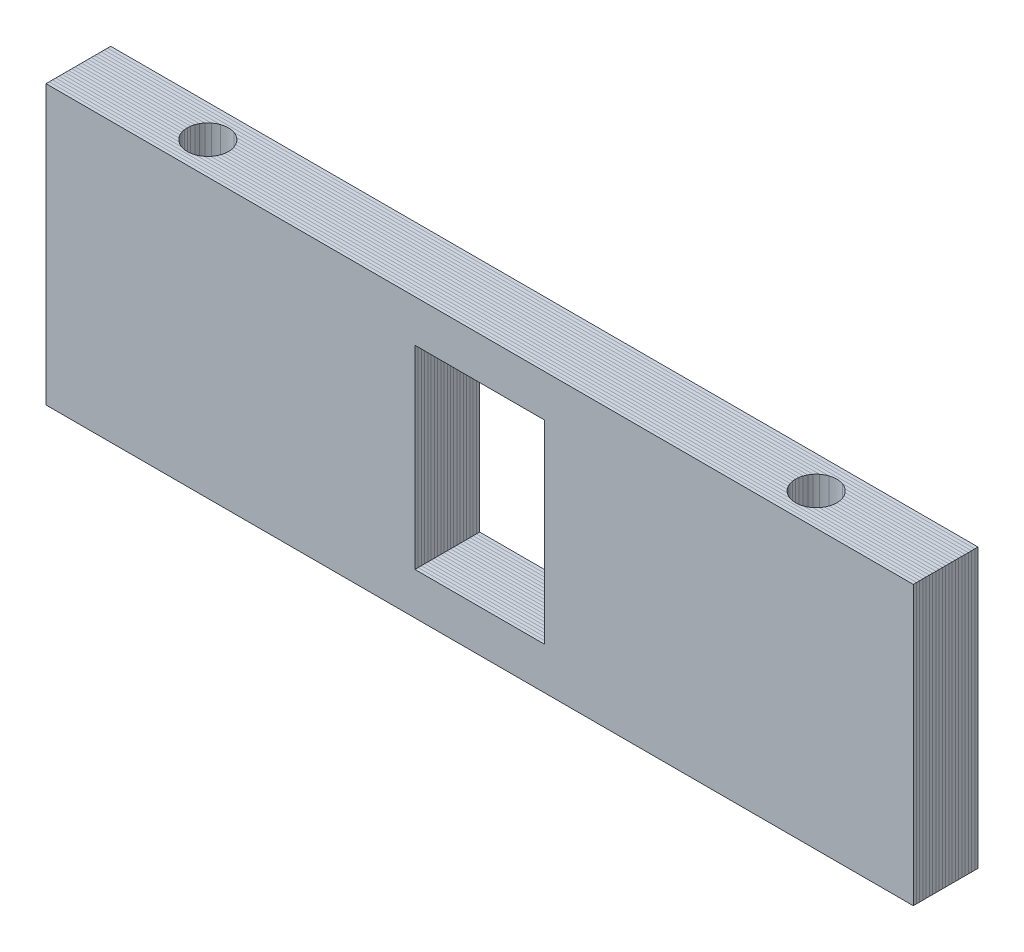
from build123d import *

# Parameters (mm, degrees)
ESBO_O1_W                                    = 134
ESBO_O1_H                                    = 43
ESBO_O1_W_2                                  = 20
ESBO_O1_H_2                                  = 30
RESSALTO_EXTRUS_O1_DEPTH                     = 0.5
ESBO_O2_W                                    = 134
ESBO_O2_H                                    = 43
ESBO_O2_W_2                                  = 20
ESBO_O2_H_2                                  = 30
RESSALTO_EXTRUS_O9_DEPTH                     = 0.5
ESBO_O7_W                                    = 134
ESBO_O7_H                                    = 43
ESBO_O7_W_2                                  = 20
ESBO_O7_H_2                                  = 30
RESSALTO_EXTRUS_O10_DEPTH                    = 0.5
ESBO_O8_W                                    = 134
ESBO_O8_H                                    = 43
ESBO_O8_W_2                                  = 20
ESBO_O8_H_2                                  = 30
RESSALTO_EXTRUS_O11_DEPTH                    = 0.5
ESBO_O9_W                                    = 134
ESBO_O9_H                                    = 43
ESBO_O9_W_2                                  = 20
ESBO_O9_H_2                                  = 30
RESSALTO_EXTRUS_O12_DEPTH                    = 0.5
ESBO_O10_W                                   = 134
ESBO_O10_H                                   = 43
ESBO_O10_W_2                                 = 20
ESBO_O10_H_2                                 = 30
RESSALTO_EXTRUS_O13_DEPTH                    = 0.5
ESBO_O11_W                                   = 134
ESBO_O11_H                                   = 43
ESBO_O11_W_2                                 = 20
ESBO_O11_H_2                                 = 30
RESSALTO_EXTRUS_O14_DEPTH                    = 0.5
ESBO_O12_W                                   = 134
ESBO_O12_H                                   = 43
ESBO_O12_W_2                                 = 20
ESBO_O12_H_2                                 = 30
RESSALTO_EXTRUS_O15_DEPTH                    = 0.5
ESBO_O13_W                                   = 134
ESBO_O13_H                                   = 43
ESBO_O13_W_2                                 = 20
ESBO_O13_H_2                                 = 30
RESSALTO_EXTRUS_O16_DEPTH                    = 0.5
ESBO_O14_W                                   = 134
ESBO_O14_H                                   = 43
ESBO_O14_W_2                                 = 20
ESBO_O14_H_2                                 = 30
RESSALTO_EXTRUS_O17_DEPTH                    = 0.5
ESBO_O15_W                                   = 134
ESBO_O15_H                                   = 43
ESBO_O15_W_2                                 = 20
ESBO_O15_H_2                                 = 30
RESSALTO_EXTRUS_O18_DEPTH                    = 0.5
ESBO_O16_W                                   = 134
ESBO_O16_H                                   = 43
ESBO_O16_W_2                                 = 20
ESBO_O16_H_2                                 = 30
RESSALTO_EXTRUS_O19_DEPTH                    = 0.5
ESBO_O17_W                                   = 134
ESBO_O17_H                                   = 43
ESBO_O17_W_2                                 = 20
ESBO_O17_H_2                                 = 30
RESSALTO_EXTRUS_O20_DEPTH                    = 0.5
ESBO_O18_W                                   = 134
ESBO_O18_H                                   = 43
ESBO_O18_W_2                                 = 20
ESBO_O18_H_2                                 = 30
RESSALTO_EXTRUS_O21_DEPTH                    = 0.5
ESBO_O19_W                                   = 134
ESBO_O19_H                                   = 43
ESBO_O19_W_2                                 = 20
ESBO_O19_H_2                                 = 30
RESSALTO_EXTRUS_O22_DEPTH                    = 0.5
ESBO_O20_W                                   = 134
ESBO_O20_H                                   = 43
ESBO_O20_W_2                                 = 20
ESBO_O20_H_2                                 = 30
RESSALTO_EXTRUS_O23_DEPTH                    = 0.5
ESBO_O21_W                                   = 134
ESBO_O21_H                                   = 43
ESBO_O21_W_2                                 = 20
ESBO_O21_H_2                                 = 30
RESSALTO_EXTRUS_O24_DEPTH                    = 0.5
ESBO_O22_W                                   = 134
ESBO_O22_H                                   = 43
ESBO_O22_W_2                                 = 20
ESBO_O22_H_2                                 = 30
RESSALTO_EXTRUS_O25_DEPTH                    = 0.5
ESBO_O23_W                                   = 134
ESBO_O23_H                                   = 43
ESBO_O23_W_2                                 = 20
ESBO_O23_H_2                                 = 30
RESSALTO_EXTRUS_O26_DEPTH                    = 0.5
ESBO_O24_W                                   = 134
ESBO_O24_H                                   = 43
ESBO_O24_W_2                                 = 20
ESBO_O24_H_2                                 = 30
RESSALTO_EXTRUS_O27_DEPTH                    = 0.5
BROCA_DE_ROSQUEAR_PARA_TARRAXA_DE_M3_2_COUNT = 2
BROCA_DE_ROSQUEAR_PARA_TARRAXA_DE_M3_2_PITCH = 94


with BuildPart() as part:
    # Esboço1 → Ressalto-extrusão1 (new body)
    with BuildSketch(Plane.XY):
        with Locations((-67, 21.5)):
            Rectangle(ESBO_O1_W, ESBO_O1_H)
        with Locations((-67, 21.5)):
            Rectangle(ESBO_O1_W_2, ESBO_O1_H_2, mode=Mode.SUBTRACT)
    extrude(amount=RESSALTO_EXTRUS_O1_DEPTH)


with BuildPart() as body_2:
    # Esboço2 → Ressalto-extrusão9 (new body)
    with BuildSketch(Plane.XY.offset(0.5)):
        with Locations((-67, 21.5)):
            Rectangle(ESBO_O2_W, ESBO_O2_H)
        with Locations((-67, 21.5)):
            Rectangle(ESBO_O2_W_2, ESBO_O2_H_2, mode=Mode.SUBTRACT)
    extrude(amount=RESSALTO_EXTRUS_O9_DEPTH)


with BuildPart() as body_3:
    # Esboço7 → Ressalto-extrusão10 (new body)
    with BuildSketch(Plane.XY.offset(1)):
        with Locations((-67, 21.5)):
            Rectangle(ESBO_O7_W, ESBO_O7_H)
        with Locations((-67, 21.5)):
            Rectangle(ESBO_O7_W_2, ESBO_O7_H_2, mode=Mode.SUBTRACT)
    extrude(amount=RESSALTO_EXTRUS_O10_DEPTH)


with BuildPart() as body_4:
    # Esboço8 → Ressalto-extrusão11 (new body)
    with BuildSketch(Plane.XY.offset(1.5)):
        with Locations((-67, 21.5)):
            Rectangle(ESBO_O8_W, ESBO_O8_H)
        with Locations((-67, 21.5)):
            Rectangle(ESBO_O8_W_2, ESBO_O8_H_2, mode=Mode.SUBTRACT)
    extrude(amount=RESSALTO_EXTRUS_O11_DEPTH)


with BuildPart() as body_5:
    # Esboço9 → Ressalto-extrusão12 (new body)
    with BuildSketch(Plane.XY.offset(2)):
        with Locations((-67, 21.5)):
            Rectangle(ESBO_O9_W, ESBO_O9_H)
        with Locations((-67, 21.5)):
            Rectangle(ESBO_O9_W_2, ESBO_O9_H_2, mode=Mode.SUBTRACT)
    extrude(amount=RESSALTO_EXTRUS_O12_DEPTH)


with BuildPart() as body_6:
    # Esboço10 → Ressalto-extrusão13 (new body)
    with BuildSketch(Plane.XY.offset(2.5)):
        with Locations((-67, 21.5)):
            Rectangle(ESBO_O10_W, ESBO_O10_H)
        with Locations((-67, 21.5)):
            Rectangle(ESBO_O10_W_2, ESBO_O10_H_2, mode=Mode.SUBTRACT)
    extrude(amount=RESSALTO_EXTRUS_O13_DEPTH)


with BuildPart() as body_7:
    # Esboço11 → Ressalto-extrusão14 (new body)
    with BuildSketch(Plane.XY.offset(3)):
        with Locations((-67, 21.5)):
            Rectangle(ESBO_O11_W, ESBO_O11_H)
        with Locations((-67, 21.5)):
            Rectangle(ESBO_O11_W_2, ESBO_O11_H_2, mode=Mode.SUBTRACT)
    extrude(amount=RESSALTO_EXTRUS_O14_DEPTH)


with BuildPart() as body_8:
    # Esboço12 → Ressalto-extrusão15 (new body)
    with BuildSketch(Plane.XY.offset(3.5)):
        with Locations((-67, 21.5)):
            Rectangle(ESBO_O12_W, ESBO_O12_H)
        with Locations((-67, 21.5)):
            Rectangle(ESBO_O12_W_2, ESBO_O12_H_2, mode=Mode.SUBTRACT)
    extrude(amount=RESSALTO_EXTRUS_O15_DEPTH)


with BuildPart() as body_9:
    # Esboço13 → Ressalto-extrusão16 (new body)
    with BuildSketch(Plane.XY.offset(4)):
        with Locations((-67, 21.5)):
            Rectangle(ESBO_O13_W, ESBO_O13_H)
        with Locations((-67, 21.5)):
            Rectangle(ESBO_O13_W_2, ESBO_O13_H_2, mode=Mode.SUBTRACT)
    extrude(amount=RESSALTO_EXTRUS_O16_DEPTH)


with BuildPart() as body_10:
    # Esboço14 → Ressalto-extrusão17 (new body)
    with BuildSketch(Plane.XY.offset(4.5)):
        with Locations((-67, 21.5)):
            Rectangle(ESBO_O14_W, ESBO_O14_H)
        with Locations((-67, 21.5)):
            Rectangle(ESBO_O14_W_2, ESBO_O14_H_2, mode=Mode.SUBTRACT)
    extrude(amount=RESSALTO_EXTRUS_O17_DEPTH)


with BuildPart() as body_11:
    # Esboço15 → Ressalto-extrusão18 (new body)
    with BuildSketch(Plane.XY.offset(5)):
        with Locations((-67, 21.5)):
            Rectangle(ESBO_O15_W, ESBO_O15_H)
        with Locations((-67, 21.5)):
            Rectangle(ESBO_O15_W_2, ESBO_O15_H_2, mode=Mode.SUBTRACT)
    extrude(amount=RESSALTO_EXTRUS_O18_DEPTH)


with BuildPart() as body_12:
    # Esboço16 → Ressalto-extrusão19 (new body)
    with BuildSketch(Plane.XY.offset(5.5)):
        with Locations((-67, 21.5)):
            Rectangle(ESBO_O16_W, ESBO_O16_H)
        with Locations((-67, 21.5)):
            Rectangle(ESBO_O16_W_2, ESBO_O16_H_2, mode=Mode.SUBTRACT)
    extrude(amount=RESSALTO_EXTRUS_O19_DEPTH)


with BuildPart() as body_13:
    # Esboço17 → Ressalto-extrusão20 (new body)
    with BuildSketch(Plane.XY.offset(6)):
        with Locations((-67, 21.5)):
            Rectangle(ESBO_O17_W, ESBO_O17_H)
        with Locations((-67, 21.5)):
            Rectangle(ESBO_O17_W_2, ESBO_O17_H_2, mode=Mode.SUBTRACT)
    extrude(amount=RESSALTO_EXTRUS_O20_DEPTH)


with BuildPart() as body_14:
    # Esboço18 → Ressalto-extrusão21 (new body)
    with BuildSketch(Plane.XY.offset(6.5)):
        with Locations((-67, 21.5)):
            Rectangle(ESBO_O18_W, ESBO_O18_H)
        with Locations((-67, 21.5)):
            Rectangle(ESBO_O18_W_2, ESBO_O18_H_2, mode=Mode.SUBTRACT)
    extrude(amount=RESSALTO_EXTRUS_O21_DEPTH)


with BuildPart() as body_15:
    # Esboço19 → Ressalto-extrusão22 (new body)
    with BuildSketch(Plane.XY.offset(7)):
        with Locations((-67, 21.5)):
            Rectangle(ESBO_O19_W, ESBO_O19_H)
        with Locations((-67, 21.5)):
            Rectangle(ESBO_O19_W_2, ESBO_O19_H_2, mode=Mode.SUBTRACT)
    extrude(amount=RESSALTO_EXTRUS_O22_DEPTH)


with BuildPart() as body_16:
    # Esboço20 → Ressalto-extrusão23 (new body)
    with BuildSketch(Plane.XY.offset(7.5)):
        with Locations((-67, 21.5)):
            Rectangle(ESBO_O20_W, ESBO_O20_H)
        with Locations((-67, 21.5)):
            Rectangle(ESBO_O20_W_2, ESBO_O20_H_2, mode=Mode.SUBTRACT)
    extrude(amount=RESSALTO_EXTRUS_O23_DEPTH)


with BuildPart() as body_17:
    # Esboço21 → Ressalto-extrusão24 (new body)
    with BuildSketch(Plane.XY.offset(8)):
        with Locations((-67, 21.5)):
            Rectangle(ESBO_O21_W, ESBO_O21_H)
        with Locations((-67, 21.5)):
            Rectangle(ESBO_O21_W_2, ESBO_O21_H_2, mode=Mode.SUBTRACT)
    extrude(amount=RESSALTO_EXTRUS_O24_DEPTH)


with BuildPart() as body_18:
    # Esboço22 → Ressalto-extrusão25 (new body)
    with BuildSketch(Plane.XY.offset(8.5)):
        with Locations((-67, 21.5)):
            Rectangle(ESBO_O22_W, ESBO_O22_H)
        with Locations((-67, 21.5)):
            Rectangle(ESBO_O22_W_2, ESBO_O22_H_2, mode=Mode.SUBTRACT)
    extrude(amount=RESSALTO_EXTRUS_O25_DEPTH)


with BuildPart() as body_19:
    # Esboço23 → Ressalto-extrusão26 (new body)
    with BuildSketch(Plane.XY.offset(9)):
        with Locations((-67, 21.5)):
            Rectangle(ESBO_O23_W, ESBO_O23_H)
        with Locations((-67, 21.5)):
            Rectangle(ESBO_O23_W_2, ESBO_O23_H_2, mode=Mode.SUBTRACT)
    extrude(amount=RESSALTO_EXTRUS_O26_DEPTH)


with BuildPart() as body_20:
    # Esboço24 → Ressalto-extrusão27 (new body)
    with BuildSketch(Plane.XY.offset(9.5)):
        with Locations((-67, 21.5)):
            Rectangle(ESBO_O24_W, ESBO_O24_H)
        with Locations((-67, 21.5)):
            Rectangle(ESBO_O24_W_2, ESBO_O24_H_2, mode=Mode.SUBTRACT)
    extrude(amount=RESSALTO_EXTRUS_O27_DEPTH)


with BuildPart() as broca_de_rosquear_para_tarraxa_de_m3x0_5_tool:
    # Esboço27 → Broca de rosquear para tarraxa de M3x0.51 (revolve)
    with BuildSketch(Plane(origin=(-114, 43, 5), x_dir=(0, 0, 1), z_dir=(1, 0, 0))):
        Polygon((0, 0), (0, 25.4), (3.175, 23.492267535), (3.175, 0), align=None)
    broca_de_rosquear_para_tarraxa_de_m3x0_5 = revolve(axis=Axis((-114, 49.35, 5), (0, -1, 0)))


with BuildPart() as body_4_1:
    add(body_4.part)

    # Broca de rosquear para tarraxa de M3x0.51: cut by broca_de_rosquear_para_tarraxa_de_m3x0_5_tool
    add(broca_de_rosquear_para_tarraxa_de_m3x0_5_tool.part, mode=Mode.SUBTRACT)


with BuildPart() as body_5_1:
    add(body_5.part)

    # Broca de rosquear para tarraxa de M3x0.51: cut by broca_de_rosquear_para_tarraxa_de_m3x0_5_tool
    add(broca_de_rosquear_para_tarraxa_de_m3x0_5_tool.part, mode=Mode.SUBTRACT)


with BuildPart() as body_6_1:
    add(body_6.part)

    # Broca de rosquear para tarraxa de M3x0.51: cut by broca_de_rosquear_para_tarraxa_de_m3x0_5_tool
    add(broca_de_rosquear_para_tarraxa_de_m3x0_5_tool.part, mode=Mode.SUBTRACT)


with BuildPart() as body_7_1:
    add(body_7.part)

    # Broca de rosquear para tarraxa de M3x0.51: cut by broca_de_rosquear_para_tarraxa_de_m3x0_5_tool
    add(broca_de_rosquear_para_tarraxa_de_m3x0_5_tool.part, mode=Mode.SUBTRACT)


with BuildPart() as body_8_1:
    add(body_8.part)

    # Broca de rosquear para tarraxa de M3x0.51: cut by broca_de_rosquear_para_tarraxa_de_m3x0_5_tool
    add(broca_de_rosquear_para_tarraxa_de_m3x0_5_tool.part, mode=Mode.SUBTRACT)


with BuildPart() as body_9_1:
    add(body_9.part)

    # Broca de rosquear para tarraxa de M3x0.51: cut by broca_de_rosquear_para_tarraxa_de_m3x0_5_tool
    add(broca_de_rosquear_para_tarraxa_de_m3x0_5_tool.part, mode=Mode.SUBTRACT)


with BuildPart() as body_10_1:
    add(body_10.part)

    # Broca de rosquear para tarraxa de M3x0.51: cut by broca_de_rosquear_para_tarraxa_de_m3x0_5_tool
    add(broca_de_rosquear_para_tarraxa_de_m3x0_5_tool.part, mode=Mode.SUBTRACT)


with BuildPart() as body_11_1:
    add(body_11.part)

    # Broca de rosquear para tarraxa de M3x0.51: cut by broca_de_rosquear_para_tarraxa_de_m3x0_5_tool
    add(broca_de_rosquear_para_tarraxa_de_m3x0_5_tool.part, mode=Mode.SUBTRACT)


with BuildPart() as body_12_1:
    add(body_12.part)

    # Broca de rosquear para tarraxa de M3x0.51: cut by broca_de_rosquear_para_tarraxa_de_m3x0_5_tool
    add(broca_de_rosquear_para_tarraxa_de_m3x0_5_tool.part, mode=Mode.SUBTRACT)


with BuildPart() as body_13_1:
    add(body_13.part)

    # Broca de rosquear para tarraxa de M3x0.51: cut by broca_de_rosquear_para_tarraxa_de_m3x0_5_tool
    add(broca_de_rosquear_para_tarraxa_de_m3x0_5_tool.part, mode=Mode.SUBTRACT)


with BuildPart() as body_14_1:
    add(body_14.part)

    # Broca de rosquear para tarraxa de M3x0.51: cut by broca_de_rosquear_para_tarraxa_de_m3x0_5_tool
    add(broca_de_rosquear_para_tarraxa_de_m3x0_5_tool.part, mode=Mode.SUBTRACT)


with BuildPart() as body_15_1:
    add(body_15.part)

    # Broca de rosquear para tarraxa de M3x0.51: cut by broca_de_rosquear_para_tarraxa_de_m3x0_5_tool
    add(broca_de_rosquear_para_tarraxa_de_m3x0_5_tool.part, mode=Mode.SUBTRACT)


with BuildPart() as body_16_1:
    add(body_16.part)

    # Broca de rosquear para tarraxa de M3x0.51: cut by broca_de_rosquear_para_tarraxa_de_m3x0_5_tool
    add(broca_de_rosquear_para_tarraxa_de_m3x0_5_tool.part, mode=Mode.SUBTRACT)


with BuildPart() as body_17_1:
    add(body_17.part)

    # Broca de rosquear para tarraxa de M3x0.51: cut by broca_de_rosquear_para_tarraxa_de_m3x0_5_tool
    add(broca_de_rosquear_para_tarraxa_de_m3x0_5_tool.part, mode=Mode.SUBTRACT)


with BuildPart() as broca_de_rosquear_para_tarraxa_de_m3_2_tool:
    # Broca de rosquear para tarraxa de M3 2: Broca de rosquear para tarraxa de M3x0.51 ×2
    with Locations(*[(i * BROCA_DE_ROSQUEAR_PARA_TARRAXA_DE_M3_2_PITCH, 0, 0) for i in range(1, BROCA_DE_ROSQUEAR_PARA_TARRAXA_DE_M3_2_COUNT)]):
        add(broca_de_rosquear_para_tarraxa_de_m3x0_5)


with BuildPart() as body_4_2:
    add(body_4_1.part)

    # Broca de rosquear para tarraxa de M3 2: cut by broca_de_rosquear_para_tarraxa_de_m3_2_tool
    add(broca_de_rosquear_para_tarraxa_de_m3_2_tool.part, mode=Mode.SUBTRACT)


with BuildPart() as body_5_2:
    add(body_5_1.part)

    # Broca de rosquear para tarraxa de M3 2: cut by broca_de_rosquear_para_tarraxa_de_m3_2_tool
    add(broca_de_rosquear_para_tarraxa_de_m3_2_tool.part, mode=Mode.SUBTRACT)


with BuildPart() as body_6_2:
    add(body_6_1.part)

    # Broca de rosquear para tarraxa de M3 2: cut by broca_de_rosquear_para_tarraxa_de_m3_2_tool
    add(broca_de_rosquear_para_tarraxa_de_m3_2_tool.part, mode=Mode.SUBTRACT)


with BuildPart() as body_7_2:
    add(body_7_1.part)

    # Broca de rosquear para tarraxa de M3 2: cut by broca_de_rosquear_para_tarraxa_de_m3_2_tool
    add(broca_de_rosquear_para_tarraxa_de_m3_2_tool.part, mode=Mode.SUBTRACT)


with BuildPart() as body_8_2:
    add(body_8_1.part)

    # Broca de rosquear para tarraxa de M3 2: cut by broca_de_rosquear_para_tarraxa_de_m3_2_tool
    add(broca_de_rosquear_para_tarraxa_de_m3_2_tool.part, mode=Mode.SUBTRACT)


with BuildPart() as body_9_2:
    add(body_9_1.part)

    # Broca de rosquear para tarraxa de M3 2: cut by broca_de_rosquear_para_tarraxa_de_m3_2_tool
    add(broca_de_rosquear_para_tarraxa_de_m3_2_tool.part, mode=Mode.SUBTRACT)


with BuildPart() as body_10_2:
    add(body_10_1.part)

    # Broca de rosquear para tarraxa de M3 2: cut by broca_de_rosquear_para_tarraxa_de_m3_2_tool
    add(broca_de_rosquear_para_tarraxa_de_m3_2_tool.part, mode=Mode.SUBTRACT)


with BuildPart() as body_11_2:
    add(body_11_1.part)

    # Broca de rosquear para tarraxa de M3 2: cut by broca_de_rosquear_para_tarraxa_de_m3_2_tool
    add(broca_de_rosquear_para_tarraxa_de_m3_2_tool.part, mode=Mode.SUBTRACT)


with BuildPart() as body_12_2:
    add(body_12_1.part)

    # Broca de rosquear para tarraxa de M3 2: cut by broca_de_rosquear_para_tarraxa_de_m3_2_tool
    add(broca_de_rosquear_para_tarraxa_de_m3_2_tool.part, mode=Mode.SUBTRACT)


with BuildPart() as body_13_2:
    add(body_13_1.part)

    # Broca de rosquear para tarraxa de M3 2: cut by broca_de_rosquear_para_tarraxa_de_m3_2_tool
    add(broca_de_rosquear_para_tarraxa_de_m3_2_tool.part, mode=Mode.SUBTRACT)


with BuildPart() as body_14_2:
    add(body_14_1.part)

    # Broca de rosquear para tarraxa de M3 2: cut by broca_de_rosquear_para_tarraxa_de_m3_2_tool
    add(broca_de_rosquear_para_tarraxa_de_m3_2_tool.part, mode=Mode.SUBTRACT)


with BuildPart() as body_15_2:
    add(body_15_1.part)

    # Broca de rosquear para tarraxa de M3 2: cut by broca_de_rosquear_para_tarraxa_de_m3_2_tool
    add(broca_de_rosquear_para_tarraxa_de_m3_2_tool.part, mode=Mode.SUBTRACT)


with BuildPart() as body_16_2:
    add(body_16_1.part)

    # Broca de rosquear para tarraxa de M3 2: cut by broca_de_rosquear_para_tarraxa_de_m3_2_tool
    add(broca_de_rosquear_para_tarraxa_de_m3_2_tool.part, mode=Mode.SUBTRACT)


with BuildPart() as body_17_2:
    add(body_17_1.part)

    # Broca de rosquear para tarraxa de M3 2: cut by broca_de_rosquear_para_tarraxa_de_m3_2_tool
    add(broca_de_rosquear_para_tarraxa_de_m3_2_tool.part, mode=Mode.SUBTRACT)


solid = Compound([part.part, body_2.part, body_3.part, body_18.part, body_19.part, body_20.part, body_4_2.part, body_5_2.part, body_6_2.part, body_7_2.part, body_8_2.part, body_9_2.part, body_10_2.part, body_11_2.part, body_12_2.part, body_13_2.part, body_14_2.part, body_15_2.part, body_16_2.part, body_17_2.part])
